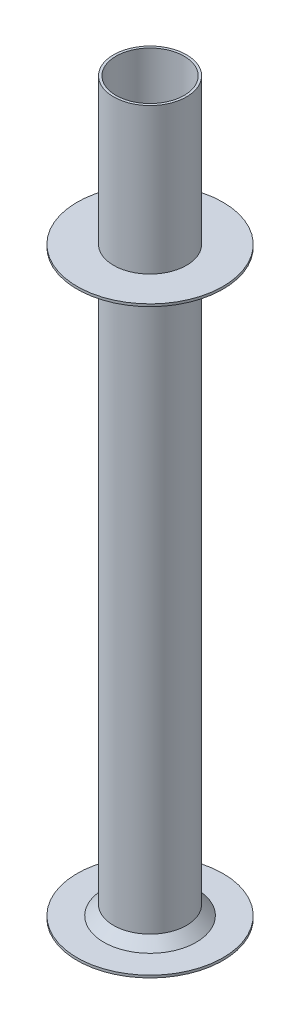
from build123d import *

# Parameters (mm, degrees)
SKETCH1_R           = 75
BOSS_EXTRUDE1_DEPTH = 1500
SKETCH3_R           = 70
CUT_EXTRUDE1_DEPTH  = 1515.925740754


with BuildPart() as part:
    # Sketch1 → Boss-Extrude1 (new body)
    with BuildSketch(Plane(origin=(0, 0, 0), x_dir=(1, 0, 0), z_dir=(0, 1, 0))):
        with Locations(Location((0, 0, 0), (0, 0, 270))):
            Circle(SKETCH1_R)
    extrude(amount=BOSS_EXTRUDE1_DEPTH)

    # Sketch2 → Revolve1 (revolve)
    with BuildSketch(Plane.XY, mode=Mode.PRIVATE) as revolve1_sk:
        Polygon((0, 0), (150, 0), (150, 5), (95, 5), (0, 100), align=None)
        Polygon((0, 1200), (150, 1200), (150, 1195), (95, 1195), (0, 1100), align=None)
    revolve(revolve1_sk.sketch.rotate(Axis((0, -133.291718303, 0), (0, 1, 0)), 90), axis=Axis((0, -133.291718303, 0), (0, 1, 0)))

    # Sketch3 → Cut-Extrude1 (cut, through all)
    with BuildSketch(Plane(origin=(0, 1500, 0), x_dir=(1, 0, 0), z_dir=(0, 1, 0))):
        with Locations(Location((0, 0, 0), (0, 0, 270))):
            Circle(SKETCH3_R)
    extrude(amount=-CUT_EXTRUDE1_DEPTH, mode=Mode.SUBTRACT)


solid = part.part
